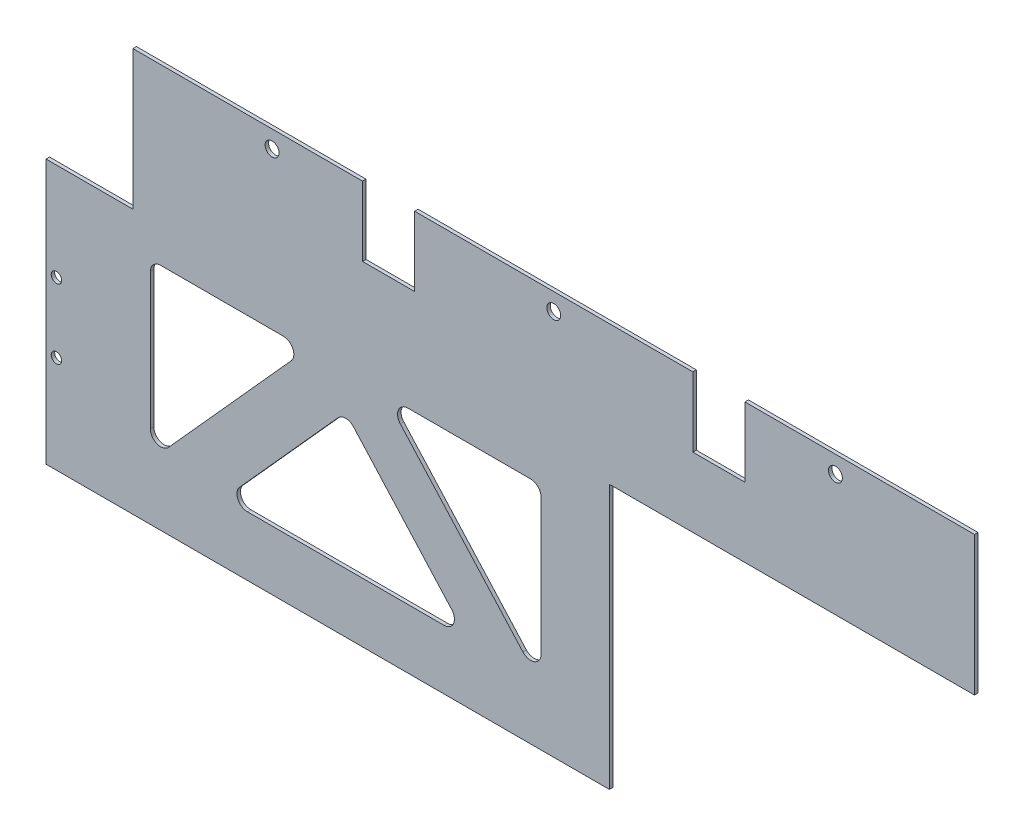
from build123d import *

# Parameters (mm, degrees)
SKETCH_1_R          = 1.5
EXTRUDE_1_DEPTH     = 1
SKETCH_2_R          = 2
SKETCH_2_W          = 15
SKETCH_2_H          = 20
CUT_EXTRUDE_1_DEPTH = 315.198981539
SKETCH_3_W          = 130
SKETCH_3_H          = 76
CUT_EXTRUDE_2_DEPTH = 315.198981539
CUT_EXTRUDE_3_REACH = 293.112
FILLET_1_R          = 3


with BuildPart() as part:
    # 草图1 → 凸台-拉伸1 (new body)
    with BuildSketch(Plane.XY):
        Polygon((0, 0), (0, 76), (25, 76), (25, 116), (267, 116), (267, 76), (292, 76), (292, 0), align=None)
        with Locations((3, 48)):
            Circle(SKETCH_1_R, mode=Mode.SUBTRACT)
        with Locations((3, 28)):
            Circle(SKETCH_1_R, mode=Mode.SUBTRACT)
        with Locations(Location((289, 28, 0), (0, 0, 180))):
            Circle(SKETCH_1_R, mode=Mode.SUBTRACT)
        with Locations(Location((289, 48, 0), (0, 0, 180))):
            Circle(SKETCH_1_R, mode=Mode.SUBTRACT)
    extrude(amount=EXTRUDE_1_DEPTH)

    # 草图2 → 切除-拉伸1 (cut, through all)
    with BuildSketch(Plane.XY.offset(1)):
        with Locations((65, 111)):
            Circle(SKETCH_2_R)
        with Locations(Location((227, 111, 0), (0, 0, 180))):
            Circle(SKETCH_2_R)
        with Locations((146, 111)):
            Circle(SKETCH_2_R)
        with Locations((193.5, 106)):
            Rectangle(SKETCH_2_W, SKETCH_2_H)
        with Locations((98.5, 106)):
            Rectangle(SKETCH_2_W, SKETCH_2_H)
    extrude(amount=-CUT_EXTRUDE_1_DEPTH, mode=Mode.SUBTRACT)

    # 草图3 → 切除-拉伸2 (cut, through all)
    with BuildSketch(Plane.XY.offset(1)):
        with Locations((227, 38)):
            Rectangle(SKETCH_3_W, SKETCH_3_H)
    extrude(amount=-CUT_EXTRUDE_2_DEPTH, mode=Mode.SUBTRACT)

    # 草图4 → 切除-拉伸3 (cut, up to next)
    with BuildSketch(Plane.XY.offset(1), mode=Mode.PRIVATE) as cut_extrude_3_sk1:
        Polygon((30, 16), (75, 66), (30, 66), align=None)
    cut_extrude_3_tool1 = extrude(cut_extrude_3_sk1.sketch, amount=-CUT_EXTRUDE_3_REACH, mode=Mode.PRIVATE) & part.part
    # 草图4 → 切除-拉伸3 (cut, up to next)
    with BuildSketch(Plane.XY.offset(1), mode=Mode.PRIVATE) as cut_extrude_3_sk2:
        Polygon((86.180436071, 17.111111111), (86.180436071, 56), (51.180436071, 17.111111111), align=None)
    cut_extrude_3_tool2 = extrude(cut_extrude_3_sk2.sketch, amount=-CUT_EXTRUDE_3_REACH, mode=Mode.PRIVATE) & part.part
    # 草图4 → 切除-拉伸3 (cut, up to next)
    with BuildSketch(Plane.XY.offset(1), mode=Mode.PRIVATE) as cut_extrude_3_sk3:
        Polygon((121.180436071, 17.111111111), (86.180436071, 56), (86.180436071, 17.111111111), align=None)
    cut_extrude_3_tool3 = extrude(cut_extrude_3_sk3.sketch, amount=-CUT_EXTRUDE_3_REACH, mode=Mode.PRIVATE) & part.part
    # 草图4 → 切除-拉伸3 (cut, up to next)
    with BuildSketch(Plane.XY.offset(1), mode=Mode.PRIVATE) as cut_extrude_3_sk4:
        Polygon((97.360872141, 66), (142.360872141, 66), (142.360872141, 16), align=None)
    cut_extrude_3_tool4 = extrude(cut_extrude_3_sk4.sketch, amount=-CUT_EXTRUDE_3_REACH, mode=Mode.PRIVATE) & part.part
    add(cut_extrude_3_tool1.solids().sort_by_distance((45, 49.333333, 1))[0], mode=Mode.SUBTRACT)
    add(cut_extrude_3_tool2.solids().sort_by_distance((74.513769, 30.074074, 1))[0], mode=Mode.SUBTRACT)
    add(cut_extrude_3_tool3.solids().sort_by_distance((97.847103, 30.074074, 1))[0], mode=Mode.SUBTRACT)
    add(cut_extrude_3_tool4.solids().sort_by_distance((127.360872, 49.333333, 1))[0], mode=Mode.SUBTRACT)

    # 圆角1
    fillet_1_edges = [part.edges().sort_by_distance(p)[0] for p in [
        (121.180436071, 17.111111111, 0.5),
        (51.180436071, 17.111111111, 0.5),
        (86.180436071, 56, 0.5),
        (97.360872141, 66, 0.5),
        (142.360872141, 66, 0.5),
        (142.360872141, 16, 0.5),
        (75, 66, 0.5),
        (30, 16, 0.5),
        (30, 66, 0.5),
    ]]
    fillet(fillet_1_edges, radius=FILLET_1_R)


solid = part.part
